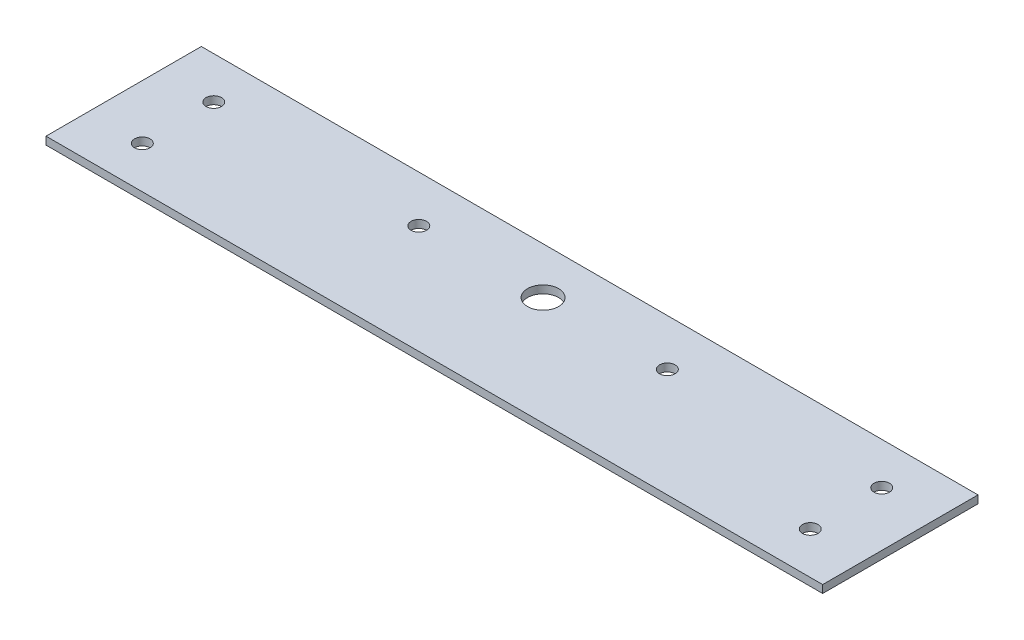
from build123d import *

# Parameters (mm, degrees)
SKETCH1_W           = 500
SKETCH1_H           = 100
BOSS_EXTRUDE1_DEPTH = 5
SKETCH3_R           = 10
CUT_EXTRUDE1_DEPTH  = 510.926465287
SKETCH4_R           = 5
CUT_EXTRUDE2_DEPTH  = 510.926465287
SKETCH5_R           = 5
CUT_EXTRUDE3_DEPTH  = 510.926465287
SKETCH7_R           = 5
CUT_EXTRUDE4_DEPTH  = 510.926465287


with BuildPart() as part:
    # Sketch1 → Boss-Extrude1 (new body)
    with BuildSketch(Plane(origin=(0, 0, 0), x_dir=(1, 0, 0), z_dir=(0, 1, 0))):
        with Locations((250, 50)):
            Rectangle(SKETCH1_W, SKETCH1_H)
    extrude(amount=BOSS_EXTRUDE1_DEPTH)

    # Sketch3 → Cut-Extrude1 (cut, through all)
    with BuildSketch(Plane(origin=(0, 5, 0), x_dir=(1, 0, 0), z_dir=(0, 1, 0))):
        with Locations(Location((250, 70, 0), (0, 0, 270))):
            Circle(SKETCH3_R)
    extrude(amount=-CUT_EXTRUDE1_DEPTH, mode=Mode.SUBTRACT)

    # Sketch4 → Cut-Extrude2 (cut, through all)
    with BuildSketch(Plane(origin=(0, 5, 0), x_dir=(1, 0, 0), z_dir=(0, 1, 0))):
        with Locations(Location((170, 70, 0), (0, 0, 270))):
            Circle(SKETCH4_R)
    extrude(amount=-CUT_EXTRUDE2_DEPTH, mode=Mode.SUBTRACT)

    # Sketch5 → Cut-Extrude3 (cut, through all)
    with BuildSketch(Plane(origin=(0, 5, 0), x_dir=(1, 0, 0), z_dir=(0, 1, 0))):
        with Locations(Location((330, 70, 0), (0, 0, 270))):
            Circle(SKETCH5_R)
    extrude(amount=-CUT_EXTRUDE3_DEPTH, mode=Mode.SUBTRACT)

    # Sketch7 → Cut-Extrude4 (cut, through all)
    with BuildSketch(Plane(origin=(0, 0, 0), x_dir=(-1, 0, 0), z_dir=(0, -1, 0))):
        with Locations(Location((-465, 73, 0), (0, 0, 90))):
            Circle(SKETCH7_R)
        with Locations(Location((-465, 27, 0), (0, 0, 90))):
            Circle(SKETCH7_R)
        with Locations(Location((-35, 27, 0), (0, 0, 90))):
            Circle(SKETCH7_R)
        with Locations(Location((-35, 73, 0), (0, 0, 90))):
            Circle(SKETCH7_R)
    extrude(amount=-CUT_EXTRUDE4_DEPTH, mode=Mode.SUBTRACT)


solid = part.part
